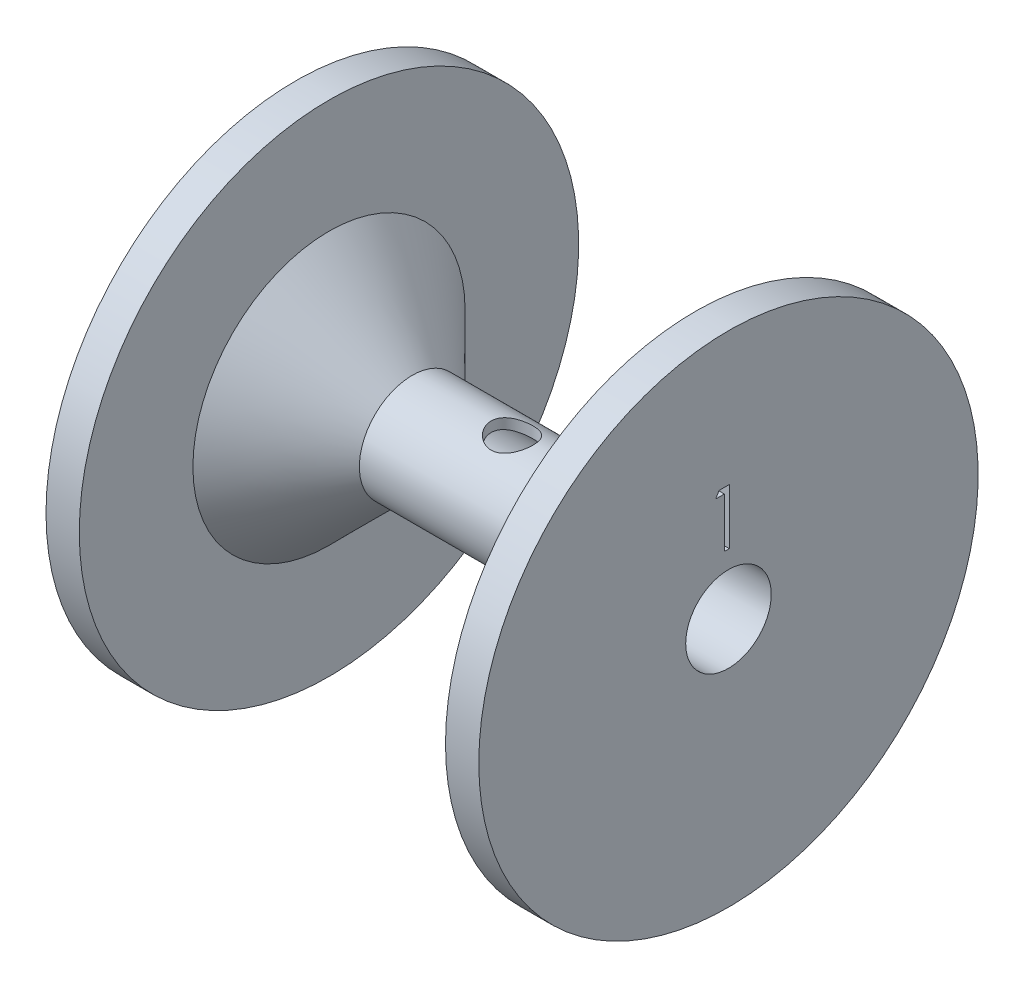
from build123d import *

# Parameters (mm, degrees)
CUT_EXTRUDE1_DEPTH      = 32.597232474
CUT_EXTRUDE1_DEPTH_BACK = 32.597232474
SKETCH2_R               = 1.6
CHAMFER1_SIZE           = 6.35
CUT_EXTRUDE2_DEPTH      = 1.27


with BuildPart() as part:
    # Sketch1 → Revolve1 (revolve)
    with BuildSketch(Plane.XY):
        Polygon((16.51, 3.2639), (16.51, 19.05), (13.97, 19.05), (13.97, 4.03225), (-13.97, 4.03225), (-13.97, 19.05), (-16.51, 19.05), (-16.51, 3.2639), align=None)
    revolve(axis=Axis((-15.275524476, 0, 0), (1, 0, 0)))

    # Sketch2 → Cut-Extrude1 (cut, two sides: drawn at the far end of the back side and taken through both)
    with BuildSketch(Plane(origin=(0, 0, 0), x_dir=(1, 0, 0), z_dir=(0, 1, 0)).offset(-CUT_EXTRUDE1_DEPTH_BACK)):
        Circle(SKETCH2_R)
    extrude(amount=CUT_EXTRUDE1_DEPTH + CUT_EXTRUDE1_DEPTH_BACK, mode=Mode.SUBTRACT)

    # Chamfer1
    chamfer1_edges = [part.edges().sort_by_distance(p)[0] for p in [
        (13.97, -4.03225, 0),
        (-13.97, -4.03225, 0),
    ]]
    chamfer(chamfer1_edges, length=CHAMFER1_SIZE)

    # Sketch3 → Cut-Extrude2 (cut)
    with BuildSketch(Plane(origin=(16.51, 0, 0), x_dir=(0, 0, -1), z_dir=(1, 0, 0))):
        Polygon((-0.720758245, 8.851363919), (0.061967449, 8.851363919), (0.061967449, 4.618030586), (-0.317947081, 4.618030586), (-0.317947081, 8.417175885), (-0.969229132, 8.417175885), align=None)
    extrude(amount=-CUT_EXTRUDE2_DEPTH, mode=Mode.SUBTRACT)


solid = part.part
